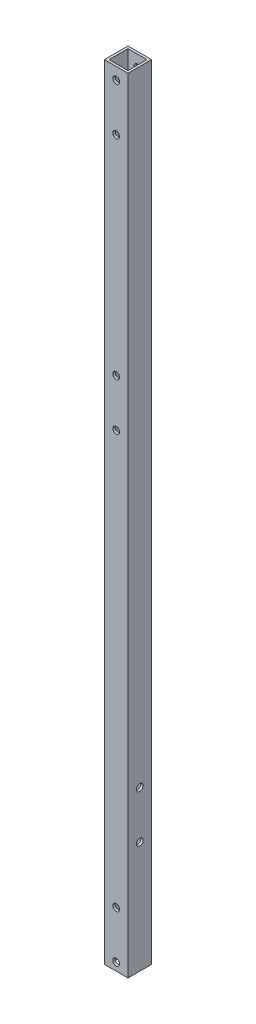
from build123d import *

# Parameters (mm, degrees)
SKETCH_1_W          = 15
SKETCH_1_H          = 15
SKETCH_1_W_2        = 12
SKETCH_1_H_2        = 12
EXTRUDE_1_DEPTH     = 497.5
SKETCH_2_R          = 2.15
CUT_EXTRUDE_1_DEPTH = 498.782583062
SKETCH_3_R          = 2.15
CUT_EXTRUDE_2_DEPTH = 498.782583062


with BuildPart() as part:
    # ｽｹｯﾁ1 → 押し出し-薄板1 (new body)
    with BuildSketch(Plane(origin=(0, 0, 0), x_dir=(1, 0, 0), z_dir=(0, 1, 0))):
        Rectangle(SKETCH_1_W, SKETCH_1_H)
        Rectangle(SKETCH_1_W_2, SKETCH_1_H_2, mode=Mode.SUBTRACT)
    extrude(amount=EXTRUDE_1_DEPTH)

    # ｽｹｯﾁ2 → ｶｯﾄ - 押し出し1 (cut, through all)
    with BuildSketch(Plane(origin=(7.5, 0, 0), x_dir=(0, 0, -1), z_dir=(1, 0, 0))):
        with Locations((0, 71)):
            Circle(SKETCH_2_R)
        with Locations((0, 101)):
            Circle(SKETCH_2_R)
    extrude(amount=-CUT_EXTRUDE_1_DEPTH, mode=Mode.SUBTRACT)

    # ｽｹｯﾁ3 → ｶｯﾄ - 押し出し2 (cut, through all)
    with BuildSketch(Plane.XY.offset(7.5)):
        with Locations((0, 35)):
            Circle(SKETCH_3_R)
        with Locations((0, 5)):
            Circle(SKETCH_3_R)
        with Locations((0, 297.5)):
            Circle(SKETCH_3_R)
        with Locations((0, 327.5)):
            Circle(SKETCH_3_R)
        with Locations((0, 490)):
            Circle(SKETCH_3_R)
        with Locations((0, 460)):
            Circle(SKETCH_3_R)
    extrude(amount=-CUT_EXTRUDE_2_DEPTH, mode=Mode.SUBTRACT)


solid = part.part
